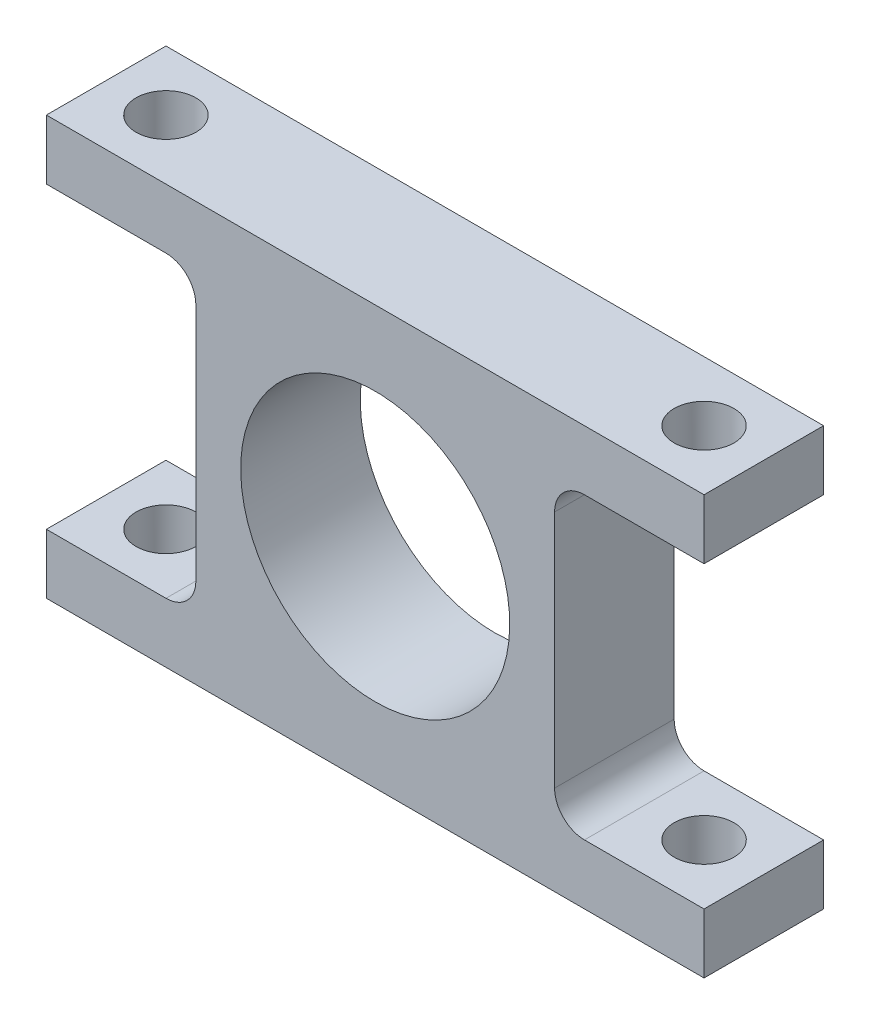
from build123d import *

# Parameters (mm, degrees)
EXTRUDE_1_DEPTH     = 8
SKETCH_2_RX         = 9
SKETCH_2_RY         = 9
CUT_EXTRUDE_1_DEPTH = 37.496575182
FILLET_1_R          = 2
SKETCH_3_R          = 2
CUT_EXTRUDE_2_DEPTH = 37.496575341


with BuildPart() as part:
    # 草图1 → 凸台-拉伸1 (new body)
    with BuildSketch(Plane.XY):
        Polygon((22, 0), (-22, 0), (-22, 4), (-12, 4), (-12, 24), (-22, 24), (-22, 28), (22, 28), (22, 24), (12, 24), (12, 4), (22, 4), align=None)
    extrude(amount=EXTRUDE_1_DEPTH)

    # 草图2 → 切除-拉伸1 (cut, through all)
    with BuildSketch(Plane.XY.offset(8)):
        with Locations(Location((0, 14), (0, 0, 180))):
            Ellipse(SKETCH_2_RX, SKETCH_2_RY)
    extrude(amount=-CUT_EXTRUDE_1_DEPTH, mode=Mode.SUBTRACT)

    # 圆角1
    fillet_1_edges = [part.edges().sort_by_distance(p)[0] for p in [
        (-12, 4, 4),
        (-12, 24, 4),
        (12, 24, 4),
        (12, 4, 4),
    ]]
    fillet(fillet_1_edges, radius=FILLET_1_R)

    # 草图3 → 切除-拉伸2 (cut, through all)
    with BuildSketch(Plane(origin=(0, 28, 0), x_dir=(1, 0, 0), z_dir=(0, 1, 0))):
        with Locations(Location((-18, -4, 0), (0, 0, 270))):
            Circle(SKETCH_3_R)
        with Locations(Location((18, -4, 0), (0, 0, 90))):
            Circle(SKETCH_3_R)
    extrude(amount=-CUT_EXTRUDE_2_DEPTH, mode=Mode.SUBTRACT)


solid = part.part
